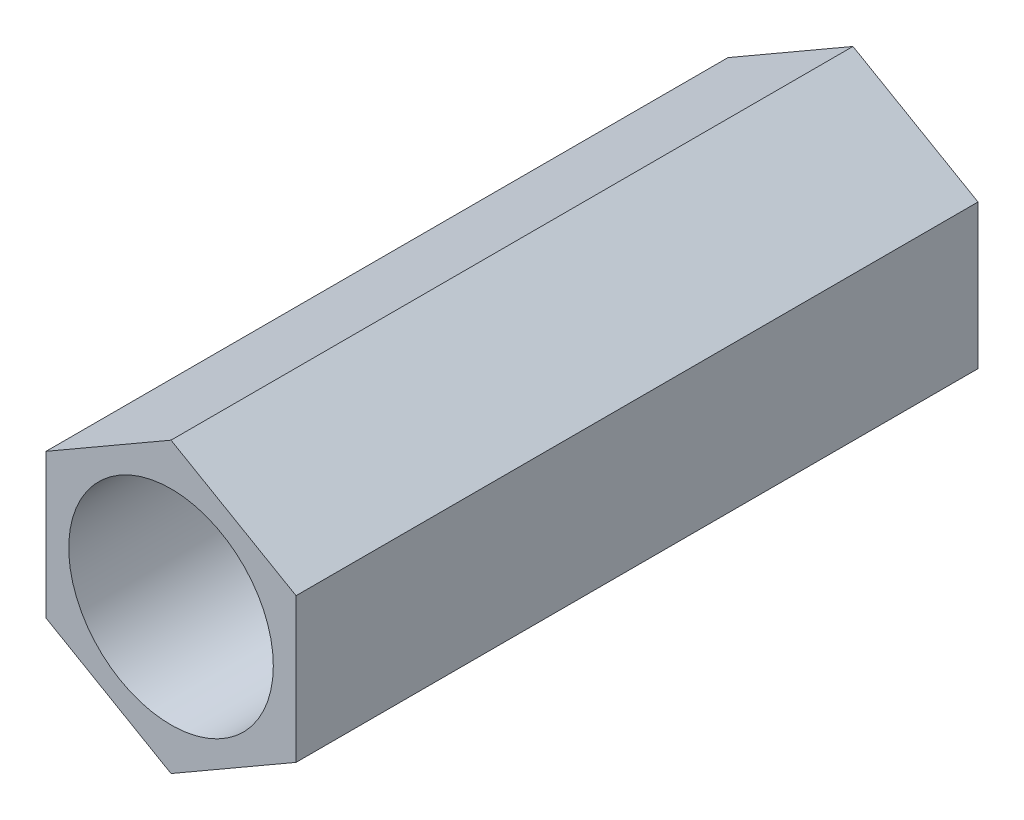
from build123d import *

# Parameters (mm, degrees)
SKETCH1_R           = 2.25
BOSS_EXTRUDE1_DEPTH = 15


with BuildPart() as part:
    # Sketch1 → Boss-Extrude1 (new body)
    with BuildSketch(Plane.XY):
        Polygon((0, 3.175426481), (-2.75, 1.58771324), (-2.75, -1.58771324), (0, -3.175426481), (2.75, -1.58771324), (2.75, 1.58771324), align=None)
        Circle(SKETCH1_R, mode=Mode.SUBTRACT)
    extrude(amount=BOSS_EXTRUDE1_DEPTH)


solid = part.part
